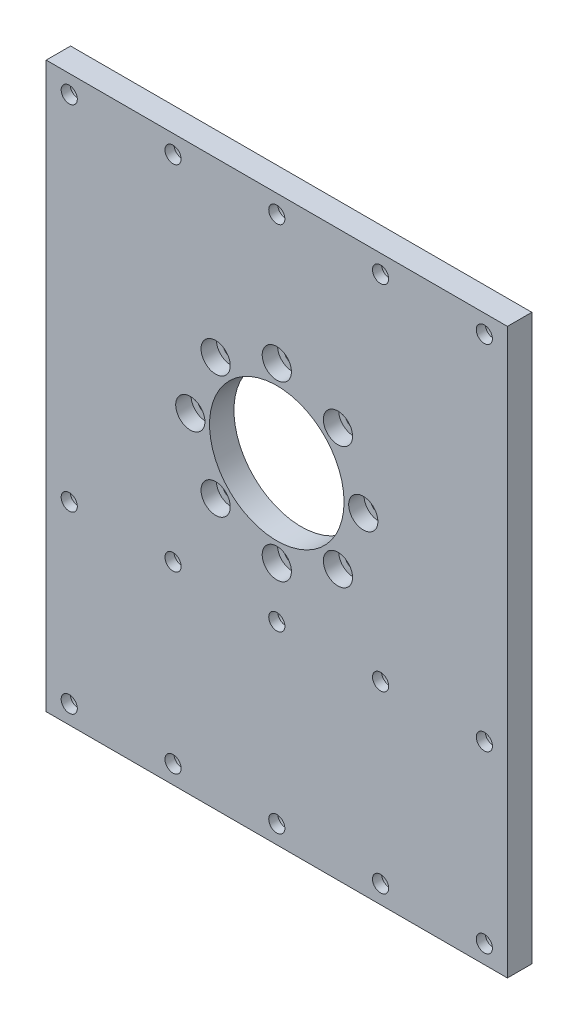
from build123d import *

# Parameters (mm, degrees)
SKETCH1_W                                    = 172
SKETCH1_H                                    = 120
BOSS_EXTRUDE1_DEPTH                          = 6.35
CBORE_FOR_M4_HEX_HEAD_CAP_SCREW1_D           = 4.2
CBORE_FOR_M4_HEX_HEAD_CAP_SCREW1_CBORE_D     = 7.6
CBORE_FOR_M4_HEX_HEAD_CAP_SCREW1_CBORE_DEPTH = 4
SKETCH4_R                                    = 17.5
CUT_EXTRUDE1_DEPTH                           = 106.053902831
CBORE_FOR_M4_HEX_HEAD_CAP_SCREW2_D           = 4.2
CBORE_FOR_M4_HEX_HEAD_CAP_SCREW2_CBORE_D     = 7.6
CBORE_FOR_M4_HEX_HEAD_CAP_SCREW2_CBORE_DEPTH = 4
SKETCH7_W                                    = 120
SKETCH7_H                                    = 25.175
CUT_EXTRUDE2_DEPTH                           = 106.053902831


with BuildPart() as part:
    # Sketch1 → Boss-Extrude1 (new body)
    with BuildSketch(Plane(origin=(0, 0, 0), x_dir=(0, 1, 0), z_dir=(0, 0, 1))):
        Rectangle(SKETCH1_W, SKETCH1_H)
    extrude(amount=BOSS_EXTRUDE1_DEPTH)

    # CBORE for M4 Hex Head Cap Screw1 (through all)
    with Locations(Plane(origin=(0, -22.5, 6.35), x_dir=(1, 0, 0), z_dir=(0, 0, 1))):
        with Locations((0, 0), (-15.909902577, 6.590097423), (-22.5, 22.5), (-15.909902577, 38.409902577), (0, 45), (15.909902577, 38.409902577), (22.5, 22.5), (15.909902577, 6.590097423)):
            CounterBoreHole(CBORE_FOR_M4_HEX_HEAD_CAP_SCREW1_D / 2, CBORE_FOR_M4_HEX_HEAD_CAP_SCREW1_CBORE_D / 2, CBORE_FOR_M4_HEX_HEAD_CAP_SCREW1_CBORE_DEPTH)

    # Sketch4 → Cut-Extrude1 (cut, through all)
    with BuildSketch(Plane.XY.offset(6.35)):
        Circle(SKETCH4_R)
    extrude(amount=-CUT_EXTRUDE1_DEPTH, mode=Mode.SUBTRACT)

    # CBORE for M4 Hex Head Cap Screw2 (through all)
    with Locations(Plane(origin=(-54, -81.2375, 0), x_dir=(-1, 0, 0), z_dir=(0, 0, -1))):
        with Locations((0, 0), (-27, 0), (-54, 0), (-81, 0), (-108, 0), (0, 45.525), (-27, 45.525), (-54, 45.525), (-81, 45.525), (-108, 45.525), (0, 137.3), (-27, 137.3), (-54, 137.3), (-81, 137.3), (-108, 137.3)):
            CounterBoreHole(CBORE_FOR_M4_HEX_HEAD_CAP_SCREW2_D / 2, CBORE_FOR_M4_HEX_HEAD_CAP_SCREW2_CBORE_D / 2, CBORE_FOR_M4_HEX_HEAD_CAP_SCREW2_CBORE_DEPTH)

    # Sketch7 → Cut-Extrude2 (cut, through all)
    with BuildSketch(Plane.XY.offset(6.35)):
        with Locations((0, 73.4125)):
            Rectangle(SKETCH7_W, SKETCH7_H)
    extrude(amount=-CUT_EXTRUDE2_DEPTH, mode=Mode.SUBTRACT)


solid = part.part
